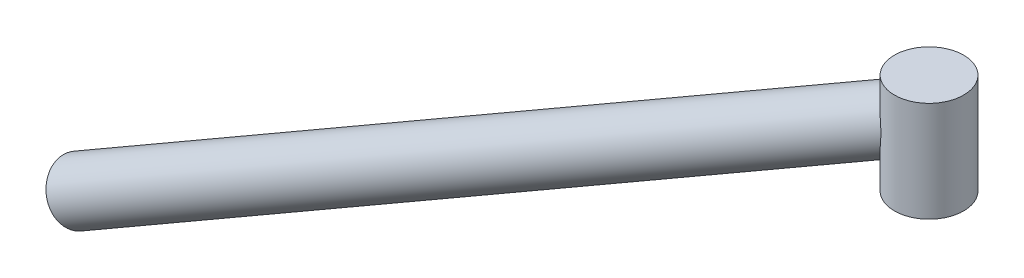
from build123d import *

# Parameters (mm, degrees)
BASE_START    = 36.5
BASE_SKETCH_R = 5
BASE_DEPTH    = 14.5


with BuildPart() as part:
    # Base Sketch → Base (new body)
    with BuildSketch(Plane(origin=(0, 0, 0), x_dir=(1, 0, 0), z_dir=(0, 1, 0)).offset(BASE_START)):
        with Locations((-6.4, 79)):
            Circle(BASE_SKETCH_R)
    extrude(amount=BASE_DEPTH)

    # Whip Sketch → Whip (revolve)
    with BuildSketch(Plane.XY.offset(-79)):
        Polygon((-6.4, 46), (-129.375607337, -25), (-127.325607337, -28.550704156), (-4.35, 42.449295844), align=None)
    revolve(axis=Axis((-2.069872981, 48.5, -79), (-0.8660254037844387, -0.49999999999999994, 0)))


solid = part.part
